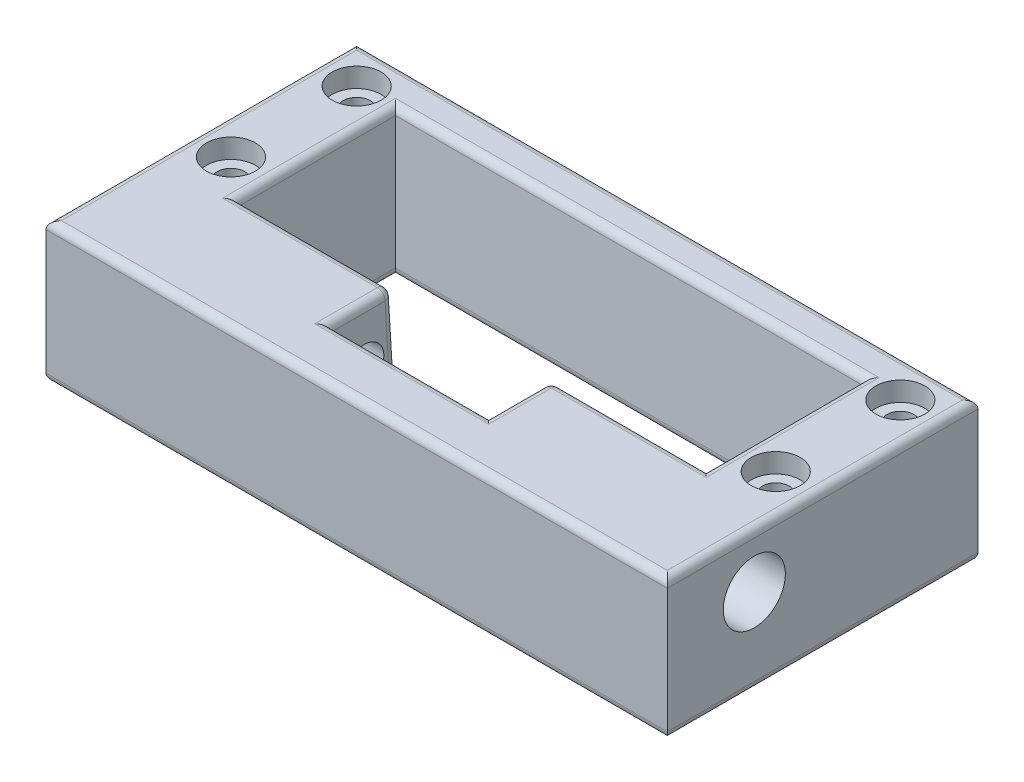
from build123d import *

# Parameters (mm, degrees)
SKETCH_1_W              = 80
SKETCH_1_H              = 40
EXTRUDE_1_DEPTH         = 18
CUT_EXTRUDE_1_DEPTH     = 49.207883173
DRAFT_1_ANGLE           = -3.5
HOLE_WIZARD_3_5_3_5_1_D = 3.5
M8X1_0_1_D              = 5
M8X1_0_1_DEPTH          = 29.8
M8X1_0_1_CBORE_D        = 8
M8X1_0_1_CBORE_DEPTH    = 22
M8X1_0_2_D              = 5
M8X1_0_2_DEPTH          = 80
M8X1_0_2_CBORE_D        = 8
M8X1_0_2_CBORE_DEPTH    = 22
FILLET_1_R              = 1
SKETCH_9_R              = 3.15
CUT_EXTRUDE_2_DEPTH     = 2.5


with BuildPart() as part:
    # ｽｹｯﾁ1 → ﾎﾞｽ - 押し出し1 (new body)
    with BuildSketch(Plane(origin=(0, 18, 0), x_dir=(1, 0, 0), z_dir=(0, 1, 0))):
        Rectangle(SKETCH_1_W, SKETCH_1_H)
    extrude(amount=-EXTRUDE_1_DEPTH)

    # ｽｹｯﾁ2 → ｶｯﾄ - 押し出し1 (cut, through all)
    with BuildSketch(Plane.XZ):
        Polygon((-10.2, 13.2), (-10.2, 4.099072837), (-29.099072837, 4.099072837), (-29.099072837, -14.099072837), (29.099072837, -14.099072837), (29.099072837, 4.099072837), (10.2, 4.099072837), (10.2, 13.2), align=None)
    extrude(amount=-CUT_EXTRUDE_1_DEPTH, mode=Mode.SUBTRACT)

    # 抜き勾配1
    draft_1_faces = [part.faces().sort_by_distance(p)[0] for p in [
        (-19.649536419, 9, 4.099072837),
        (-29.099072837, 9, -5),
        (0, 9, -14.099072837),
        (29.099072837, 9, -5),
        (19.649536419, 9, 4.099072837),
    ]]
    draft(draft_1_faces, Plane(origin=(0, 0, 0), x_dir=(0, 0, -1), z_dir=(0, -1, 0)), DRAFT_1_ANGLE)

    # Ø3.5 (3.5) 直径の穴1 (through all)
    with Locations(Plane(origin=(0, 18, 0), x_dir=(1, 0, 0), z_dir=(0, 1, 0))):
        with Locations((-35.186293991, -1), (-35, 15), (34.958159373, -1), (35, 15)):
            Hole(HOLE_WIZARD_3_5_3_5_1_D / 2)

    # M8x1.0 ねじ穴1
    with Locations(Plane(origin=(40, 0, 0), x_dir=(0, 0, -1), z_dir=(1, 0, 0))):
        with Locations((-8.8, 11)):
            CounterBoreHole(M8X1_0_1_D / 2, M8X1_0_1_CBORE_D / 2, M8X1_0_1_CBORE_DEPTH, depth=M8X1_0_1_DEPTH)

    # M8x1.0 ねじ穴2
    with Locations(Plane.ZY.offset(40)):
        with Locations((8.8, 11)):
            CounterBoreHole(M8X1_0_2_D / 2, M8X1_0_2_CBORE_D / 2, M8X1_0_2_CBORE_DEPTH, depth=M8X1_0_2_DEPTH)

    # ﾌｨﾚｯﾄ1
    fillet_1_edges = [part.edges().sort_by_distance(p)[0] for p in [
        (40, 0, 0),
        (0, 0, -20),
        (0, 18, 13.2),
        (10.2, 18, 9.2),
        (20.2, 18, 5.2),
        (10.2, 9, 4.649536419),
        (30.2, 18, -5),
        (0, 18, -15.2),
        (-30.2, 18, -5),
        (-20.2, 18, 5.2),
        (-10.2, 18, 9.2),
        (-10.2, 9, 4.649536419),
        (0, 0, 13.2),
        (-10.2, 0, 8.649536419),
        (-19.649536419, 0, 4.099072837),
        (-29.099072837, 0, -5),
        (0, 0, -14.099072837),
        (29.099072837, 0, -5),
        (19.649536419, 0, 4.099072837),
        (10.2, 0, 8.649536419),
        (-40, 0, 0),
        (0, 18, -20),
        (40, 18, 0),
        (0, 18, 20),
        (-40, 18, 0),
        (0, 0, 20),
    ]]
    fillet(fillet_1_edges, radius=FILLET_1_R)

    # ｽｹｯﾁ9 → ｶｯﾄ - 押し出し2 (cut)
    with BuildSketch(Plane(origin=(0, 18, 0), x_dir=(1, 0, 0), z_dir=(0, 1, 0))):
        with Locations(Location((35, 15, 0), (0, 0, 270))):
            Circle(SKETCH_9_R)
        with Locations(Location((34.958159373, -1, 0), (0, 0, 270))):
            Circle(SKETCH_9_R)
        with Locations(Location((-35, 15, 0), (0, 0, 270))):
            Circle(SKETCH_9_R)
        with Locations(Location((-35.186293991, -1, 0), (0, 0, 270))):
            Circle(SKETCH_9_R)
    extrude(amount=-CUT_EXTRUDE_2_DEPTH, mode=Mode.SUBTRACT)


solid = part.part
